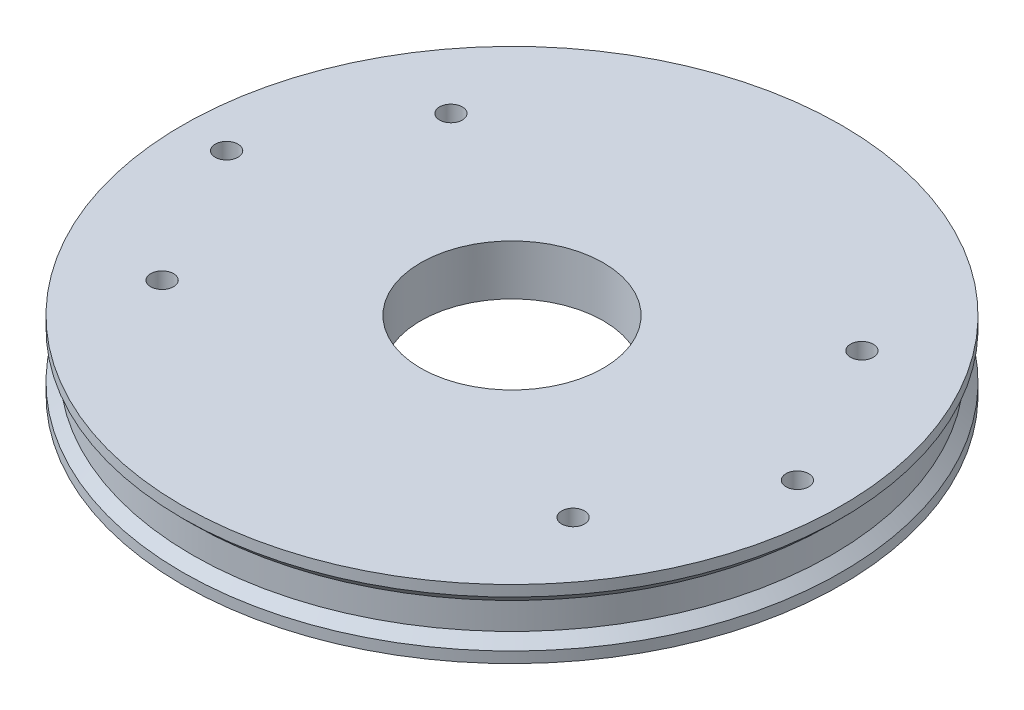
from build123d import *

# Parameters (mm, degrees)
SKETCH1_R           = 72.175
SKETCH1_R_2         = 20
BOSS_EXTRUDE1_DEPTH = 7.5
SKETCH3_R           = 30.5
CUT_EXTRUDE1_DEPTH  = 4
SKETCH4_R           = 2.5
CUT_EXTRUDE2_DEPTH  = 104.167151991


with BuildPart() as part:
    # Sketch1 → Boss-Extrude1 (new, symmetric)
    with BuildSketch(Plane(origin=(0, 0, 0), x_dir=(1, 0, 0), z_dir=(0, 1, 0))):
        with Locations(Location((0, 0, 0), (0, 0, 270))):
            Circle(SKETCH1_R)
        with Locations(Location((0, 0, 0), (0, 0, 270))):
            Circle(SKETCH1_R_2, mode=Mode.SUBTRACT)
    extrude(amount=BOSS_EXTRUDE1_DEPTH, both=True)

    # Sketch2 → Cut-Revolve1 (revolve, cut)
    with BuildSketch(Plane.XY, mode=Mode.PRIVATE) as cut_revolve1_sk:
        Polygon((72.175, -5.115), (72.175, 5.115), (70, 2.94), (70, -2.94), align=None)
    revolve(cut_revolve1_sk.sketch.rotate(Axis((0, 6.6, 0), (0, -1, 0)), 90), axis=Axis((0, 6.6, 0), (0, -1, 0)), mode=Mode.SUBTRACT)

    # Sketch3 → Cut-Extrude1 (cut)
    with BuildSketch(Plane.XZ.offset(7.5)):
        with Locations(Location((0, 0, 0), (0, 0, 270))):
            Circle(SKETCH3_R)
    extrude(amount=-CUT_EXTRUDE1_DEPTH, mode=Mode.SUBTRACT)

    # Sketch4 → Cut-Extrude2 (cut, through all)
    with BuildSketch(Plane(origin=(0, 7.5, 0), x_dir=(1, 0, 0), z_dir=(0, 1, 0))):
        with Locations(Location((62.5, 0, 0), (0, 0, 270))):
            Circle(SKETCH4_R)
        with Locations(Location((45, 31.622776602, 0), (0, 0, 270))):
            Circle(SKETCH4_R)
        with Locations(Location((45, -31.622776602, 0), (0, 0, 270))):
            Circle(SKETCH4_R)
    cut_extrude2 = extrude(amount=-CUT_EXTRUDE2_DEPTH, mode=Mode.SUBTRACT)

    # Mirror1: Cut-Extrude2 across plane
    add(cut_extrude2.mirror(Plane(origin=(0, 0, 0), x_dir=(0, 0, 1), z_dir=(1, 0, 0))), mode=Mode.SUBTRACT)


solid = part.part
